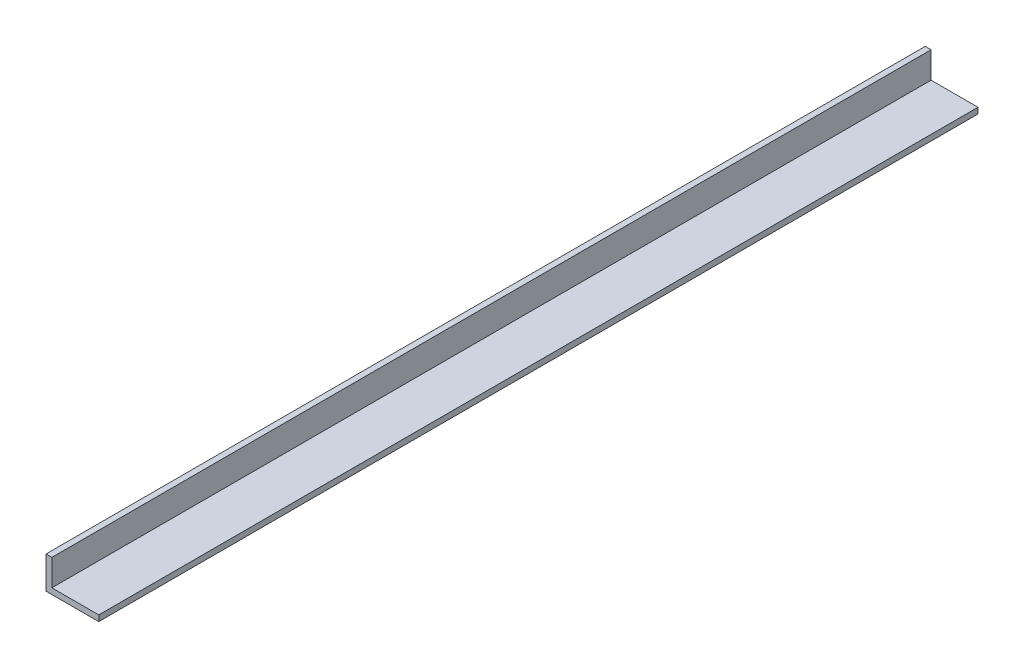
from build123d import *

# Parameters (mm, degrees)
BOSS_EXTRUDE1_DEPTH = 476.25


with BuildPart() as part:
    # Sketch1 → Boss-Extrude1 (new body)
    with BuildSketch(Plane.XY):
        Polygon((0, 17.4625), (0, 0), (28.575, 0), (28.575, 3.175), (3.175, 3.175), (3.175, 17.4625), align=None)
    extrude(amount=BOSS_EXTRUDE1_DEPTH)


solid = part.part
